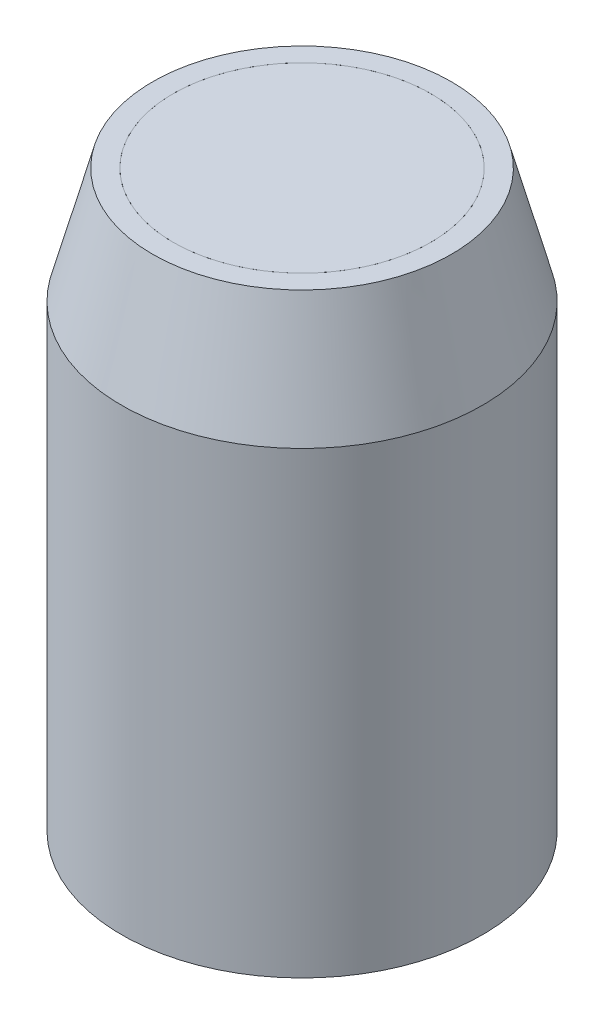
from build123d import *

# Parameters (mm, degrees)
SKETCH1_R           = 5
BOSS_EXTRUDE1_DEPTH = 19.874493393


with BuildPart() as part:
    # Sketch1 → Boss-Extrude1 (new body)
    with BuildSketch(Plane(origin=(0, 0, 0), x_dir=(1, 0, 0), z_dir=(0, 1, 0))):
        with Locations(Location((0, 0, 0), (0, 0, 270))):
            Circle(SKETCH1_R)
    extrude(amount=BOSS_EXTRUDE1_DEPTH)


with BuildPart() as body_2:
    # Sketch2 → Revolve1 (revolve)
    with BuildSketch(Plane.XY, mode=Mode.PRIVATE) as revolve1_sk:
        Polygon((0, 0), (-5, 0), (-5, 19.874493393), (-5.8, 19.874493393), (-7, 15.396032424), (-7, -2.4), (0, -2.4), align=None)
    revolve(revolve1_sk.sketch.rotate(Axis((0, 0, 0), (0, 1, 0)), 270), axis=Axis((0, 0, 0), (0, 1, 0)))


solid = Compound([part.part, body_2.part])
